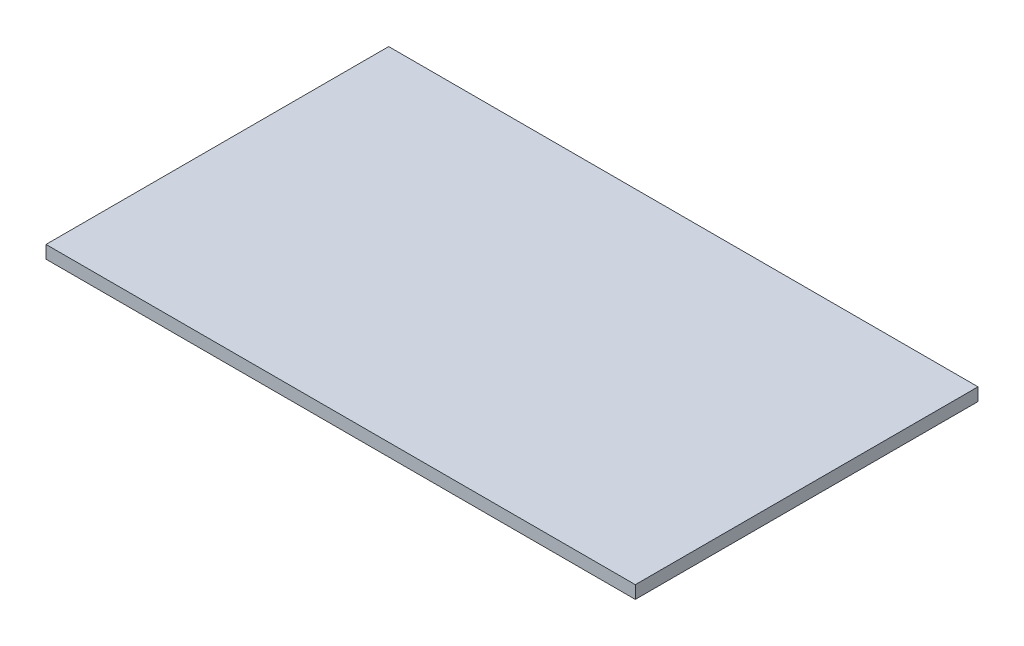
from build123d import *

# Parameters (mm, degrees)
SKETCH1_W           = 1168.4
SKETCH1_H           = 679.45
BOSS_EXTRUDE1_DEPTH = 25.4


with BuildPart() as part:
    # Sketch1 → Boss-Extrude1 (new body)
    with BuildSketch(Plane(origin=(0, 0, 0), x_dir=(1, 0, 0), z_dir=(0, 1, 0))):
        with Locations((584.2, 339.725)):
            Rectangle(SKETCH1_W, SKETCH1_H)
    extrude(amount=BOSS_EXTRUDE1_DEPTH)


solid = part.part
